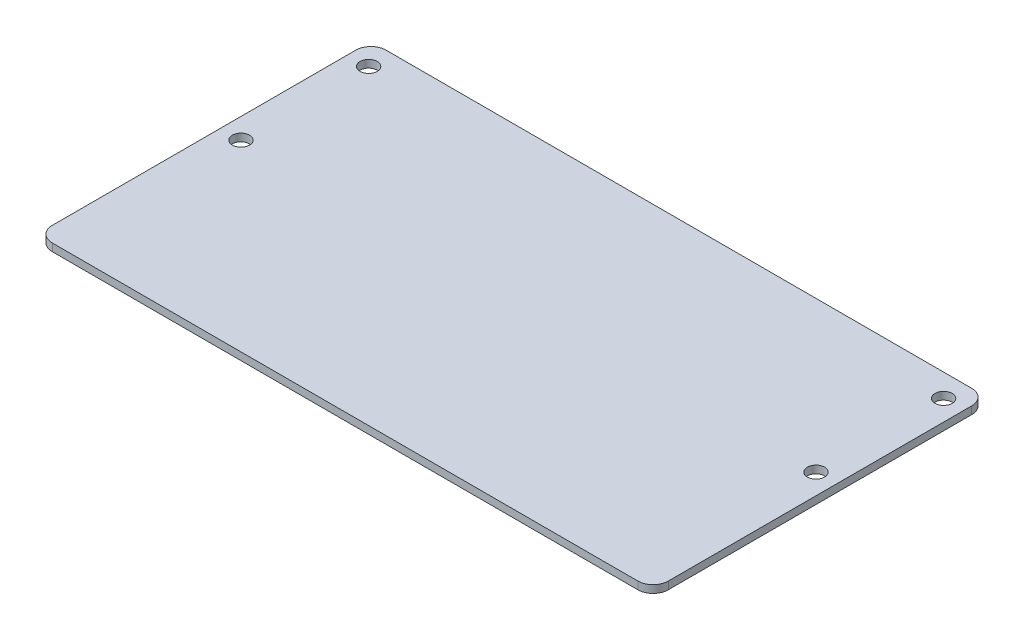
from build123d import *

# Parameters (mm, degrees)
ESQUISSE1_W             = 121.6
ESQUISSE1_H             = 65.9
BOSS_EXTRU_1_DEPTH      = 1.5
CONG_1_R                = 3
ESQUISSE2_R             = 1.7
ENL_V_MAT_EXTRU_1_DEPTH = 70.170748876


with BuildPart() as part:
    # Esquisse1 → Boss.-Extru.1 (new body)
    with BuildSketch(Plane(origin=(0, 0, 0), x_dir=(1, 0, 0), z_dir=(0, 1, 0))):
        Rectangle(ESQUISSE1_W, ESQUISSE1_H)
    extrude(amount=BOSS_EXTRU_1_DEPTH)

    # Congé1
    cong_1_edges = [part.edges().sort_by_distance(p)[0] for p in [
        (60.8, 0.75, 32.95),
        (-60.8, 0.75, 32.95),
        (-60.8, 0.75, -32.95),
        (60.8, 0.75, -32.95),
    ]]
    fillet(cong_1_edges, radius=CONG_1_R)

    # Esquisse2 → Enlèv. mat.-Extru.1 (cut, through all)
    with BuildSketch(Plane(origin=(0, 1.5, 0), x_dir=(1, 0, 0), z_dir=(0, 1, 0))):
        with Locations(Location((-56.75, 28.45, 0), (0, 0, 270))):
            Circle(ESQUISSE2_R)
        with Locations(Location((-56.75, 3.25, 0), (0, 0, 270))):
            Circle(ESQUISSE2_R)
        with Locations(Location((56.75, 28.45, 0), (0, 0, 270))):
            Circle(ESQUISSE2_R)
        with Locations(Location((56.75, 3.25, 0), (0, 0, 270))):
            Circle(ESQUISSE2_R)
    extrude(amount=-ENL_V_MAT_EXTRU_1_DEPTH, mode=Mode.SUBTRACT)


solid = part.part
